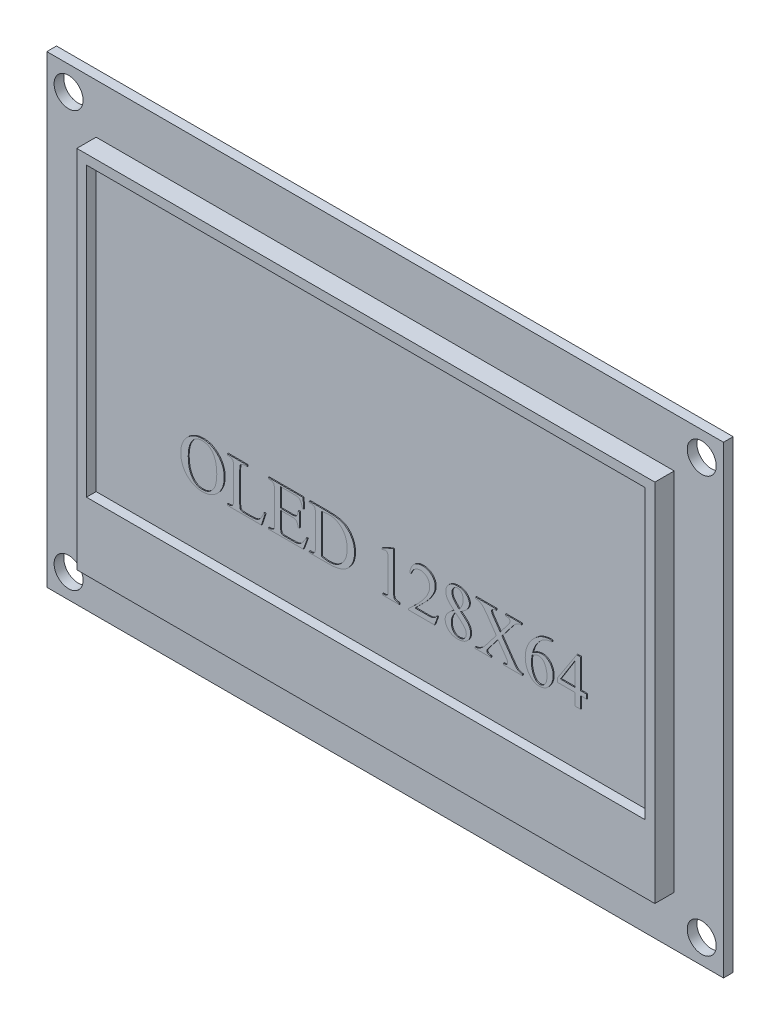
from build123d import *

# Parameters (mm, degrees)
SKETCH_1_W          = 70
SKETCH_1_H          = 48
SKETCH_1_R          = 1.5
EXTRUDE_1_DEPTH     = 1
SKETCH_2_W          = 59.8
SKETCH_2_H          = 37.76
EXTRUDE_2_DEPTH     = 2
SKETCH_3_W          = 57.8
SKETCH_3_H          = 29.76
CUT_EXTRUDE_1_DEPTH = 1
EXTRUDE_3_DEPTH     = 0.1


with BuildPart() as part:
    # 草图1 → 凸台-拉伸1 (new body)
    with BuildSketch(Plane.XY):
        Rectangle(SKETCH_1_W, SKETCH_1_H)
        with Locations((32.75, -21.5)):
            Circle(SKETCH_1_R, mode=Mode.SUBTRACT)
        with Locations((-32.75, -21.5)):
            Circle(SKETCH_1_R, mode=Mode.SUBTRACT)
        with Locations((-32.75, 21.5)):
            Circle(SKETCH_1_R, mode=Mode.SUBTRACT)
        with Locations((32.75, 21.5)):
            Circle(SKETCH_1_R, mode=Mode.SUBTRACT)
    extrude(amount=EXTRUDE_1_DEPTH)

    # 草图2 → 凸台-拉伸2 (add)
    with BuildSketch(Plane.XY.offset(1)):
        Rectangle(SKETCH_2_W, SKETCH_2_H)
    extrude(amount=EXTRUDE_2_DEPTH)

    # 草图3 → 切除-拉伸1 (cut)
    with BuildSketch(Plane.XY.offset(3)):
        with Locations((0, 3.005725137)):
            Rectangle(SKETCH_3_W, SKETCH_3_H)
    extrude(amount=-CUT_EXTRUDE_1_DEPTH, mode=Mode.SUBTRACT)

    # 草图4 → 凸台-拉伸3 (add)
    # profile 1 of 10: a face of its own
    with BuildSketch(Plane.XY.offset(2)):
        with BuildLine():
            add(Edge.make_bspline(
                [(-17.753586123, -1.530934014), (-17.680218489, -1.532610624), (-17.535429437, -1.535919368), (-17.322451314, -1.569802119), (-17.116597062, -1.621593606), (-16.917768793, -1.694892085), (-16.727562194, -1.791569104), (-16.543953872, -1.907092204), (-16.368802784, -2.044912859), (-16.202965684, -2.20102301), (-16.049996212, -2.372250454), (-15.915569805, -2.556399611), (-15.803381402, -2.751979509), (-15.70980029, -2.956836452), (-15.638689347, -3.172985397), (-15.587938124, -3.399438043), (-15.555678704, -3.636162092), (-15.552212638, -3.797503808), (-15.550450251, -3.879541062)],
                knots=[0, 0, 0, 0, 0.98202372, 1.937997388, 2.881027266, 3.822118876, 4.769670076, 5.734044671, 6.723305605, 7.75005001, 8.781230837, 9.794598944, 10.798037779, 11.796394559, 12.806380977, 13.83982627, 14.901618723, 16, 16, 16, 16], degree=3))
            add(Edge.make_bspline(
                [(-15.550450251, -3.879541062), (-15.55221896, -3.964245851), (-15.555685042, -4.130239117), (-15.587617387, -4.37378712), (-15.639870529, -4.605647044), (-15.710776437, -4.827690851), (-15.804922402, -5.037706921), (-15.918561774, -5.237732402), (-16.053989226, -5.425855072), (-16.207714857, -5.601342109), (-16.375661417, -5.760569713), (-16.554244215, -5.900268236), (-16.741768998, -6.018364462), (-16.937983201, -6.115267612), (-17.143296444, -6.189939013), (-17.357147798, -6.242963543), (-17.579668365, -6.275974983), (-17.731065996, -6.280188886), (-17.807761595, -6.282323581)],
                knots=[0, 0, 0, 0, 1.105289212, 2.165999938, 3.199623363, 4.204615257, 5.203215799, 6.19840424, 7.202665855, 8.223554404, 9.239475005, 10.219225154, 11.178454701, 12.127257531, 13.070460396, 14.024390953, 14.999188307, 16, 16, 16, 16], degree=3))
            add(Edge.make_bspline(
                [(-17.807761595, -6.282323581), (-17.885479121, -6.280694591), (-18.038263195, -6.277492174), (-18.261746487, -6.243375751), (-18.476416557, -6.193471043), (-18.680710998, -6.11895934), (-18.877066361, -6.025807916), (-19.062394966, -5.909294048), (-19.239764668, -5.774393726), (-19.403699126, -5.618272176), (-19.554109037, -5.446419077), (-19.68614253, -5.260512719), (-19.797028295, -5.061509884), (-19.887314439, -4.850498674), (-19.959271868, -4.628029152), (-20.008741327, -4.392638579), (-20.039567584, -4.145221771), (-20.043169884, -3.975946108), (-20.04500795, -3.889573557)],
                knots=[0, 0, 0, 0, 1.016462961, 1.998253932, 2.952703386, 3.896991157, 4.838708659, 5.79220409, 6.756996177, 7.750938477, 8.749908999, 9.742163126, 10.729801125, 11.72586164, 12.741928676, 13.785044703, 14.869823709, 16, 16, 16, 16], degree=3))
            add(Edge.make_bspline(
                [(-20.04500795, -3.889573557), (-20.042612612, -3.801512474), (-20.037912748, -3.628728905), (-20.00339739, -3.375550609), (-19.94570941, -3.134537044), (-19.862378015, -2.906615248), (-19.758126194, -2.690503476), (-19.629323097, -2.487479723), (-19.477581064, -2.296306115), (-19.360094198, -2.181828096), (-19.300596831, -2.123854461)],
                knots=[0, 0, 0, 0, 1.069821612, 2.099083859, 3.098457433, 4.075397538, 5.042245682, 6.008393354, 6.991416173, 8, 8, 8, 8], degree=3))
            add(Edge.make_bspline(
                [(-19.300596831, -2.123854461), (-19.246307998, -2.076258383), (-19.139039001, -1.982213564), (-18.964122508, -1.861802014), (-18.781655851, -1.759828797), (-18.591142231, -1.676274329), (-18.393040617, -1.610641242), (-18.186657547, -1.564816855), (-17.97279535, -1.535695966), (-17.827252682, -1.532534297), (-17.753586123, -1.530934014)],
                knots=[0, 0, 0, 0, 1.020331703, 2.016067603, 2.996330227, 3.972568804, 4.953652495, 5.942660639, 6.958675748, 8, 8, 8, 8], degree=3))
        make_face()
        with BuildLine():
            add(Edge.make_bspline(
                [(-17.81779409, -1.723557916), (-17.868044049, -1.724762323), (-17.966709884, -1.727127176), (-18.110638861, -1.749986438), (-18.246967611, -1.785876205), (-18.375798048, -1.836349985), (-18.496558509, -1.901997676), (-18.60990929, -1.981840252), (-18.715036683, -2.076843695), (-18.777319637, -2.149230761), (-18.809004583, -2.186055929)],
                knots=[0, 0, 0, 0, 1.063164563, 2.087524502, 3.076733094, 4.043076796, 5.009316746, 5.979698113, 6.972220307, 8, 8, 8, 8], degree=3))
            add(Edge.make_bspline(
                [(-18.809004583, -2.186055929), (-18.846704258, -2.236058423), (-18.923205511, -2.337524904), (-19.016722635, -2.508549497), (-19.097510987, -2.694770606), (-19.162002118, -2.898705521), (-19.213194815, -3.118718217), (-19.248386131, -3.35559836), (-19.271081388, -3.608553393), (-19.273346761, -3.782842707), (-19.274512344, -3.872518315)],
                knots=[0, 0, 0, 0, 0.842079542, 1.708771735, 2.616192816, 3.571533622, 4.583868732, 5.654197247, 6.793033924, 8, 8, 8, 8], degree=3))
            add(Edge.make_bspline(
                [(-19.274512344, -3.872518315), (-19.272857458, -3.964521515), (-19.269639019, -4.143450263), (-19.248039654, -4.403989243), (-19.209747198, -4.647908027), (-19.158441933, -4.876057513), (-19.09015781, -5.08761196), (-19.006689535, -5.282550644), (-18.91028387, -5.462844523), (-18.831053644, -5.570202055), (-18.791949341, -5.623188669)],
                knots=[0, 0, 0, 0, 1.194090181, 2.32227859, 3.389791915, 4.396332156, 5.354391058, 6.270237594, 7.146270854, 8, 8, 8, 8], degree=3))
            add(Edge.make_bspline(
                [(-18.791949341, -5.623188669), (-18.760676884, -5.660422356), (-18.699381319, -5.733402225), (-18.594638949, -5.827925118), (-18.483539104, -5.909616356), (-18.363994261, -5.975483216), (-18.237222533, -6.027665233), (-18.102914478, -6.063061636), (-17.961393143, -6.086231118), (-17.864373229, -6.088526475), (-17.814784342, -6.08969968)],
                knots=[0, 0, 0, 0, 1.03798799, 2.034507832, 3.00651136, 3.978961382, 4.943739978, 5.928402204, 6.941163471, 8, 8, 8, 8], degree=3))
            add(Edge.make_bspline(
                [(-17.814784342, -6.08969968), (-17.761854509, -6.088210363), (-17.657770414, -6.08528169), (-17.505264446, -6.060577566), (-17.360077494, -6.020161662), (-17.221155796, -5.965121118), (-17.090638517, -5.892115093), (-16.966598867, -5.80387169), (-16.850669568, -5.698796433), (-16.740431975, -5.579314156), (-16.640274336, -5.442022338), (-16.554066218, -5.285533039), (-16.482304548, -5.110135392), (-16.421991891, -4.917256272), (-16.376756307, -4.705586194), (-16.343649951, -4.476026515), (-16.325231982, -4.227969645), (-16.322406453, -4.056476653), (-16.320945857, -3.967827017)],
                knots=[0, 0, 0, 0, 0.868053581, 1.706987682, 2.527029803, 3.33706135, 4.152464395, 4.974651475, 5.829494242, 6.714957667, 7.637961825, 8.610582419, 9.638758338, 10.742501093, 11.922087167, 13.186154705, 14.545442825, 16, 16, 16, 16], degree=3))
            add(Edge.make_bspline(
                [(-16.320945857, -3.967827017), (-16.32208267, -3.871464513), (-16.324280597, -3.685156287), (-16.347101574, -3.415186181), (-16.382019435, -3.163913784), (-16.433296188, -2.931560576), (-16.49758456, -2.717527053), (-16.578694168, -2.523113345), (-16.671120075, -2.345366296), (-16.748618701, -2.24101389), (-16.786453618, -2.190068927)],
                knots=[0, 0, 0, 0, 1.235800575, 2.389309172, 3.472797871, 4.487583422, 5.438786723, 6.335007093, 7.187148569, 8, 8, 8, 8], degree=3))
            add(Edge.make_bspline(
                [(-16.786453618, -2.190068927), (-16.817948502, -2.152709305), (-16.880185923, -2.078882505), (-16.989085265, -1.984996018), (-17.105069716, -1.903643246), (-17.230281452, -1.836998444), (-17.364749, -1.785510383), (-17.508000239, -1.75008478), (-17.659867941, -1.726960646), (-17.76419847, -1.724712705), (-17.81779409, -1.723557916)],
                knots=[0, 0, 0, 0, 0.998031887, 1.97222284, 2.930434429, 3.891254661, 4.86556567, 5.867574261, 6.904551903, 8, 8, 8, 8], degree=3))
        make_face(mode=Mode.SUBTRACT)
    # profile 2 of 10: a face of its own
    with BuildSketch(Plane.XY.offset(2)):
        with BuildLine():
            Line((-11.441140355, -4.998164239), (-11.312724421, -5.021238977))
            Line((-11.312724421, -5.021238977), (-11.697972224, -6.218115614))
            Line((-11.697972224, -6.218115614), (-15.229410416, -6.218115614))
            Line((-15.229410416, -6.218115614), (-15.229410416, -6.08969968))
            Line((-15.229410416, -6.08969968), (-15.061867751, -6.08969968))
            add(Edge.make_bspline(
                [(-15.061867751, -6.08969968), (-15.039097151, -6.089159443), (-14.995036787, -6.088114101), (-14.931429728, -6.079026974), (-14.872573715, -6.063835478), (-14.818576141, -6.043452507), (-14.769938753, -6.015495164), (-14.727216454, -5.981193813), (-14.688067007, -5.941925747), (-14.667144458, -5.911481322), (-14.656554959, -5.896072529)],
                knots=[0, 0, 0, 0, 1.161464265, 2.247395222, 3.269655372, 4.258323134, 5.183235525, 6.118634609, 7.047787219, 8, 8, 8, 8], degree=3))
            add(Edge.make_bspline(
                [(-14.656554959, -5.896072529), (-14.650878321, -5.885512089), (-14.638177203, -5.861883769), (-14.625357763, -5.819602636), (-14.613249861, -5.769055335), (-14.603088495, -5.709423776), (-14.597152211, -5.640624754), (-14.590322679, -5.562777669), (-14.587985466, -5.476058071), (-14.58755525, -5.415180573), (-14.587330744, -5.383412042)],
                knots=[0, 0, 0, 0, 0.550464559, 1.231629699, 2.022772906, 2.943490705, 4.010570548, 5.198880139, 6.538253567, 8, 8, 8, 8], degree=3))
            Line((-14.587330744, -5.383412042), (-14.587330744, -2.429845554))
            add(Edge.make_bspline(
                [(-14.587330744, -2.429845554), (-14.587283632, -2.3947208), (-14.587194284, -2.328108003), (-14.592946337, -2.233135776), (-14.599242719, -2.148377144), (-14.609077902, -2.073987372), (-14.62189801, -2.009819252), (-14.637871211, -1.956276666), (-14.654735947, -1.911241113), (-14.671789999, -1.887821168), (-14.679629697, -1.877055087)],
                knots=[0, 0, 0, 0, 1.484107705, 2.814555366, 4.019988359, 5.075390106, 5.984573864, 6.780592097, 7.4394417, 8, 8, 8, 8], degree=3))
            add(Edge.make_bspline(
                [(-14.679629697, -1.877055087), (-14.702636773, -1.853317399), (-14.748887556, -1.805597876), (-14.840099963, -1.756979383), (-14.946158626, -1.728945092), (-15.021882673, -1.725419538), (-15.061867751, -1.723557916)],
                knots=[0, 0, 0, 0, 0.928124107, 1.865794122, 2.873060895, 4, 4, 4, 4], degree=3))
            Line((-15.061867751, -1.723557916), (-15.229410416, -1.723557916))
            Line((-15.229410416, -1.723557916), (-15.229410416, -1.595141982))
            Line((-15.229410416, -1.595141982), (-13.174755468, -1.595141982))
            Line((-13.174755468, -1.595141982), (-13.174755468, -1.723557916))
            add(Edge.make_bspline(
                [(-13.174755468, -1.723557916), (-13.231290633, -1.723895673), (-13.335463528, -1.724518032), (-13.478086572, -1.73466924), (-13.594188123, -1.75327529), (-13.685399853, -1.782426687), (-13.755993366, -1.819253513), (-13.813248765, -1.858114076), (-13.85869119, -1.902041844), (-13.888060874, -1.94385914), (-13.905902747, -1.983523237), (-13.916217944, -2.021800212), (-13.925257632, -2.068396947), (-13.931770772, -2.123766048), (-13.937661458, -2.187993437), (-13.943135026, -2.260879646), (-13.944351489, -2.342561188), (-13.944940895, -2.399749767), (-13.945251073, -2.429845554)],
                knots=[0, 0, 0, 0, 2.135388661, 3.934712435, 5.396921196, 6.567476567, 7.533666755, 8.395801069, 9.173040373, 9.908931797, 10.310428977, 10.810209104, 11.402366068, 12.102810591, 12.914896488, 13.839298742, 14.862919719, 16, 16, 16, 16], degree=3))
            Line((-13.945251073, -2.429845554), (-13.945251073, -5.471697997))
            add(Edge.make_bspline(
                [(-13.945251073, -5.471697997), (-13.945114638, -5.517243418), (-13.944864333, -5.600801356), (-13.932563959, -5.71407113), (-13.920143628, -5.806175311), (-13.899925859, -5.856839303), (-13.891075601, -5.879017288)],
                knots=[0, 0, 0, 0, 1.320237883, 2.422117385, 3.309287413, 4, 4, 4, 4], degree=3))
            add(Edge.make_bspline(
                [(-13.891075601, -5.879017288), (-13.875394231, -5.901940503), (-13.843496168, -5.948569475), (-13.786341569, -5.985820752), (-13.7376202, -5.999666935), (-13.699650522, -6.006447385), (-13.650731188, -6.012120473), (-13.590826343, -6.016971996), (-13.519907946, -6.020857917), (-13.437969565, -6.024099562), (-13.34463626, -6.024382257), (-13.27875791, -6.025108381), (-13.243979682, -6.025491713)],
                knots=[0, 0, 0, 0, 1.192840014, 2.426400607, 2.832970907, 3.376643165, 4.08937609, 4.958642829, 5.97093294, 7.155619234, 8.498406181, 10, 10, 10, 10], degree=3))
            Line((-13.243979682, -6.025491713), (-12.910900853, -6.025491713))
            add(Edge.make_bspline(
                [(-12.910900853, -6.025491713), (-12.869094126, -6.025416143), (-12.788468939, -6.025270404), (-12.67241101, -6.020900448), (-12.565654324, -6.015293607), (-12.468883256, -6.006611197), (-12.381927782, -5.994338804), (-12.304883959, -5.980580538), (-12.236998469, -5.964904293), (-12.159259104, -5.939699694), (-12.070953322, -5.896358113), (-11.970692188, -5.83203506), (-11.876073323, -5.750584565), (-11.784593746, -5.651817239), (-11.695989977, -5.529372944), (-11.60989169, -5.378798053), (-11.522418251, -5.19948693), (-11.469374136, -5.068098392), (-11.441140355, -4.998164239)],
                knots=[0, 0, 0, 0, 1.015520045, 1.958452593, 2.820964462, 3.612367469, 4.317791521, 4.953587295, 5.513193728, 6.009017938, 6.935641285, 7.893331651, 8.89609874, 9.959585258, 11.157137459, 12.558834018, 14.168371213, 16, 16, 16, 16], degree=3))
        make_face()
    # profile 3 of 10: a face of its own
    with BuildSketch(Plane.XY.offset(2)):
        with BuildLine():
            Line((-9.707525243, -1.787765883), (-9.707525243, -3.714004897))
            Line((-9.707525243, -3.714004897), (-8.615989802, -3.714004897))
            add(Edge.make_bspline(
                [(-8.615989802, -3.714004897), (-8.58521749, -3.713557714), (-8.526305639, -3.712701609), (-8.44189614, -3.707977769), (-8.365444919, -3.699228649), (-8.297119513, -3.68615626), (-8.236651364, -3.670338842), (-8.183975815, -3.651550351), (-8.13880321, -3.628973936), (-8.114080351, -3.609088722), (-8.102326065, -3.599634455)],
                knots=[0, 0, 0, 0, 1.378497325, 2.639055229, 3.785499939, 4.822596556, 5.752813006, 6.582149435, 7.325894273, 8, 8, 8, 8], degree=3))
            add(Edge.make_bspline(
                [(-8.102326065, -3.599634455), (-8.088183223, -3.586318067), (-8.059405503, -3.559222008), (-8.023461153, -3.510100471), (-7.992144379, -3.454528673), (-7.966456917, -3.391630308), (-7.944017905, -3.321996566), (-7.927607263, -3.244991095), (-7.915245558, -3.160878166), (-7.91160133, -3.102400493), (-7.909702164, -3.071925225)],
                knots=[0, 0, 0, 0, 0.807057727, 1.642193325, 2.520961646, 3.456744241, 4.464785926, 5.562353087, 6.729635801, 8, 8, 8, 8], degree=3))
            Line((-7.909702164, -3.071925225), (-7.781286229, -3.071925225))
            Line((-7.781286229, -3.071925225), (-7.781286229, -4.548708469))
            Line((-7.781286229, -4.548708469), (-7.909702164, -4.548708469))
            add(Edge.make_bspline(
                [(-7.909702164, -4.548708469), (-7.917046466, -4.500822886), (-7.930337565, -4.414163603), (-7.952730439, -4.298828327), (-7.975272057, -4.211477313), (-7.994921515, -4.164660416), (-8.003004366, -4.145402176)],
                knots=[0, 0, 0, 0, 1.400091839, 2.533767946, 3.396862008, 4, 4, 4, 4], degree=3))
            add(Edge.make_bspline(
                [(-8.003004366, -4.145402176), (-8.013653455, -4.127143607), (-8.035067831, -4.090427242), (-8.081380073, -4.044006985), (-8.135445801, -4.002666676), (-8.20106331, -3.9677342), (-8.279868321, -3.939326396), (-8.376092572, -3.920043733), (-8.489967291, -3.908570681), (-8.572150233, -3.907304322), (-8.615989802, -3.906628798)],
                knots=[0, 0, 0, 0, 0.730339962, 1.468649003, 2.255043961, 3.085373338, 4.035675664, 5.150343399, 6.479882613, 8, 8, 8, 8], degree=3))
            Line((-8.615989802, -3.906628798), (-9.707525243, -3.906628798))
            Line((-9.707525243, -3.906628798), (-9.707525243, -5.487749988))
            add(Edge.make_bspline(
                [(-9.707525243, -5.487749988), (-9.707735356, -5.512834531), (-9.708136053, -5.560672229), (-9.705450266, -5.628537496), (-9.703936108, -5.688768852), (-9.700886141, -5.740948156), (-9.697191573, -5.785509816), (-9.69174774, -5.822183596), (-9.687869135, -5.851757599), (-9.674235373, -5.891610418), (-9.64128514, -5.940268315), (-9.589532535, -5.983925006), (-9.530661403, -6.004941673), (-9.470375627, -6.017600005), (-9.393946867, -6.023542103), (-9.337998093, -6.024799951), (-9.307228698, -6.025491713)],
                knots=[0, 0, 0, 0, 1.288677705, 2.45758408, 3.489098831, 4.38406774, 5.143209633, 5.784735894, 6.290376563, 6.670724524, 7.93849931, 9.258749462, 10.069240206, 11.124103354, 12.418381796, 14, 14, 14, 14], degree=3))
            Line((-9.307228698, -6.025491713), (-8.484564119, -6.025491713))
            add(Edge.make_bspline(
                [(-8.484564119, -6.025491713), (-8.420684074, -6.024610177), (-8.302198075, -6.022975087), (-8.138595701, -6.014212094), (-8.0030749, -5.996558042), (-7.890374354, -5.972122864), (-7.793038898, -5.933668381), (-7.702171727, -5.88242056), (-7.612332018, -5.818498037), (-7.557614782, -5.766375291), (-7.529470608, -5.739565609)],
                knots=[0, 0, 0, 0, 1.488287981, 2.760506628, 3.813793052, 4.66981318, 5.439445504, 6.241513751, 7.095510901, 8, 8, 8, 8], degree=3))
            add(Edge.make_bspline(
                [(-7.529470608, -5.739565609), (-7.491511045, -5.698120407), (-7.410189587, -5.609331599), (-7.298611772, -5.452106082), (-7.183883879, -5.268259524), (-7.112581363, -5.133436133), (-7.074998591, -5.062372206)],
                knots=[0, 0, 0, 0, 0.823493647, 1.764185327, 2.821526682, 4, 4, 4, 4], degree=3))
            Line((-7.074998591, -5.062372206), (-6.946582657, -5.062372206))
            Line((-6.946582657, -5.062372206), (-7.362931194, -6.218115614))
            Line((-7.362931194, -6.218115614), (-10.991684585, -6.218115614))
            Line((-10.991684585, -6.218115614), (-10.991684585, -6.08969968))
            Line((-10.991684585, -6.08969968), (-10.833171167, -6.08969968))
            add(Edge.make_bspline(
                [(-10.833171167, -6.08969968), (-10.807013633, -6.088730495), (-10.754602401, -6.086788561), (-10.677369364, -6.071189906), (-10.601977501, -6.046239247), (-10.554980756, -6.021806502), (-10.531193071, -6.009439721)],
                knots=[0, 0, 0, 0, 0.993225946, 1.990103322, 2.982678719, 4, 4, 4, 4], degree=3))
            add(Edge.make_bspline(
                [(-10.531193071, -6.009439721), (-10.514638047, -5.999746991), (-10.481897188, -5.980577684), (-10.441944932, -5.940265589), (-10.408730927, -5.894652912), (-10.38401615, -5.837358444), (-10.36770875, -5.762044571), (-10.356700898, -5.661608627), (-10.350244136, -5.532309406), (-10.349831783, -5.436257662), (-10.349604914, -5.383412042)],
                knots=[0, 0, 0, 0, 0.66731377, 1.319745957, 1.964608581, 2.628644155, 3.481257446, 4.645895262, 6.154643106, 8, 8, 8, 8], degree=3))
            Line((-10.349604914, -5.383412042), (-10.349604914, -2.429845554))
            add(Edge.make_bspline(
                [(-10.349604914, -2.429845554), (-10.349709071, -2.393392461), (-10.349905993, -2.324473254), (-10.353701217, -2.226391543), (-10.361124086, -2.139480451), (-10.368697054, -2.063125857), (-10.382910783, -1.998516869), (-10.39554324, -1.943852819), (-10.413139963, -1.900015997), (-10.428854308, -1.876527358), (-10.43588437, -1.866019343)],
                knots=[0, 0, 0, 0, 1.515681782, 2.865589051, 4.07921189, 5.143357036, 6.051434242, 6.827115058, 7.475291317, 8, 8, 8, 8], degree=3))
            add(Edge.make_bspline(
                [(-10.43588437, -1.866019343), (-10.45792076, -1.843913551), (-10.503648468, -1.798041825), (-10.597218237, -1.753506976), (-10.709043586, -1.728045708), (-10.789869243, -1.725123483), (-10.833171167, -1.723557916)],
                knots=[0, 0, 0, 0, 0.855227083, 1.774681568, 2.807797254, 4, 4, 4, 4], degree=3))
            Line((-10.833171167, -1.723557916), (-10.991684585, -1.723557916))
            Line((-10.991684585, -1.723557916), (-10.991684585, -1.595141982))
            Line((-10.991684585, -1.595141982), (-7.396038427, -1.595141982))
            Line((-7.396038427, -1.595141982), (-7.331830459, -2.622469456))
            Line((-7.331830459, -2.622469456), (-7.460246394, -2.622469456))
            add(Edge.make_bspline(
                [(-7.460246394, -2.622469456), (-7.466519412, -2.590350751), (-7.47856326, -2.528684611), (-7.497180185, -2.440188356), (-7.517802234, -2.359793396), (-7.536907276, -2.286804636), (-7.558684049, -2.222202272), (-7.579023594, -2.164875501), (-7.601157523, -2.115730036), (-7.630537156, -2.060468914), (-7.672774413, -1.999826109), (-7.735654413, -1.938130943), (-7.80798294, -1.883717584), (-7.863345692, -1.857399841), (-7.891643673, -1.843947854)],
                knots=[0, 0, 0, 0, 1.262230624, 2.423413114, 3.48701335, 4.463268595, 5.332045682, 6.115542347, 6.808324797, 7.408465274, 8.528517928, 9.641194136, 10.794325741, 12, 12, 12, 12], degree=3))
            add(Edge.make_bspline(
                [(-7.891643673, -1.843947854), (-7.919540568, -1.834761032), (-7.983181578, -1.813803193), (-8.096016892, -1.800170506), (-8.234478517, -1.788277409), (-8.336034672, -1.787946069), (-8.391261917, -1.787765883)],
                knots=[0, 0, 0, 0, 0.696394265, 1.588679787, 2.688700125, 4, 4, 4, 4], degree=3))
            Line((-8.391261917, -1.787765883), (-9.707525243, -1.787765883))
        make_face()
    # profile 4 of 10: a face of its own
    with BuildSketch(Plane.XY.offset(2)):
        with BuildLine():
            Line((-6.753958755, -6.218115614), (-6.753958755, -6.08969968))
            Line((-6.753958755, -6.08969968), (-6.586416091, -6.08969968))
            add(Edge.make_bspline(
                [(-6.586416091, -6.08969968), (-6.563644828, -6.089162262), (-6.51958318, -6.088122376), (-6.455985092, -6.078997114), (-6.397399754, -6.064016161), (-6.343788182, -6.043331414), (-6.296216136, -6.015239484), (-6.252160308, -5.983665936), (-6.214715787, -5.943723603), (-6.194404606, -5.913429086), (-6.184113047, -5.898079028)],
                knots=[0, 0, 0, 0, 1.170016541, 2.263943595, 3.293731011, 4.273677885, 5.205400736, 6.126759273, 7.050839703, 8, 8, 8, 8], degree=3))
            add(Edge.make_bspline(
                [(-6.184113047, -5.898079028), (-6.178130823, -5.887181214), (-6.16496147, -5.86319061), (-6.150438666, -5.820527973), (-6.139010395, -5.769321008), (-6.128867387, -5.709375622), (-6.121313516, -5.640699059), (-6.114994818, -5.562765517), (-6.112497862, -5.476061599), (-6.112091265, -5.415181783), (-6.111879084, -5.383412042)],
                knots=[0, 0, 0, 0, 0.568141805, 1.250715472, 2.052584266, 2.968455247, 4.031571596, 5.213625719, 6.545948453, 8, 8, 8, 8], degree=3))
            Line((-6.111879084, -5.383412042), (-6.111879084, -2.429845554))
            add(Edge.make_bspline(
                [(-6.111879084, -2.429845554), (-6.111831972, -2.3947208), (-6.111742624, -2.328108003), (-6.117494677, -2.233135776), (-6.123791059, -2.148377144), (-6.133626242, -2.073987372), (-6.14644635, -2.009819252), (-6.162419551, -1.956276666), (-6.179284287, -1.911241113), (-6.196338339, -1.887821168), (-6.204178037, -1.877055087)],
                knots=[0, 0, 0, 0, 1.484107705, 2.814555366, 4.019988359, 5.075390106, 5.984573864, 6.780592097, 7.4394417, 8, 8, 8, 8], degree=3))
            add(Edge.make_bspline(
                [(-6.204178037, -1.877055087), (-6.227185113, -1.853317399), (-6.273435896, -1.805597876), (-6.364648303, -1.756979383), (-6.470706966, -1.728945092), (-6.546431013, -1.725419538), (-6.586416091, -1.723557916)],
                knots=[0, 0, 0, 0, 0.928124107, 1.865794122, 2.873060895, 4, 4, 4, 4], degree=3))
            Line((-6.586416091, -1.723557916), (-6.753958755, -1.723557916))
            Line((-6.753958755, -1.723557916), (-6.753958755, -1.595141982))
            Line((-6.753958755, -1.595141982), (-4.859823725, -1.595141982))
            add(Edge.make_bspline(
                [(-4.859823725, -1.595141982), (-4.775537427, -1.595934095), (-4.611906532, -1.59747188), (-4.374341665, -1.608670348), (-4.152044031, -1.626104777), (-3.945826594, -1.651985804), (-3.755003394, -1.685179051), (-3.579491667, -1.724417461), (-3.419580415, -1.772460404), (-3.274072909, -1.828221232), (-3.139250074, -1.892119934), (-3.013142813, -1.966633932), (-2.893369879, -2.050084649), (-2.779940108, -2.142954014), (-2.674079906, -2.246442447), (-2.574099277, -2.359152582), (-2.481854588, -2.482367036), (-2.395971134, -2.613834305), (-2.318712988, -2.753252776), (-2.251572292, -2.898876794), (-2.194327501, -3.04974493), (-2.146776403, -3.205790838), (-2.110675105, -3.367471251), (-2.08645042, -3.534541254), (-2.06917295, -3.706622802), (-2.067583838, -3.823314486), (-2.066777155, -3.88255081)],
                knots=[0, 0, 0, 0, 1.467398357, 2.848763231, 4.139747069, 5.348651221, 6.465709142, 7.510884705, 8.477890948, 9.369935066, 10.221521294, 11.072291092, 11.917022873, 12.760911509, 13.621447043, 14.491775058, 15.381421868, 16.298684439, 17.223858558, 18.153856654, 19.088127867, 20.031156851, 20.991691223, 21.969088183, 22.969046064, 24, 24, 24, 24], degree=3))
            add(Edge.make_bspline(
                [(-2.066777155, -3.88255081), (-2.068332319, -3.961564825), (-2.071380512, -4.116435921), (-2.100645569, -4.343631505), (-2.146357298, -4.5609086), (-2.210503326, -4.768761918), (-2.294194445, -4.966254793), (-2.396533778, -5.153634372), (-2.515044456, -5.332821026), (-2.609284062, -5.441239854), (-2.656687853, -5.495775984)],
                knots=[0, 0, 0, 0, 1.077719575, 2.112379846, 3.120154608, 4.104514829, 5.075810074, 6.041644454, 7.014920789, 8, 8, 8, 8], degree=3))
            add(Edge.make_bspline(
                [(-2.656687853, -5.495775984), (-2.684730532, -5.525258213), (-2.741015161, -5.584432171), (-2.832474752, -5.666244116), (-2.928881474, -5.742747463), (-3.030887271, -5.813246446), (-3.138026733, -5.878333908), (-3.250809334, -5.937927082), (-3.369462052, -5.990582922), (-3.492777033, -6.039114469), (-3.621905854, -6.081035239), (-3.756052635, -6.1182299), (-3.896011993, -6.149429142), (-4.041431498, -6.173990248), (-4.191953761, -6.194357413), (-4.34794625, -6.208263961), (-4.50927201, -6.216172878), (-4.618700814, -6.217461696), (-4.67422257, -6.218115614)],
                knots=[0, 0, 0, 0, 0.884547214, 1.775380039, 2.665826882, 3.559504879, 4.469980105, 5.390593375, 6.331323642, 7.291529335, 8.271228182, 9.282197471, 10.317896576, 11.387954191, 12.488469157, 13.620281033, 14.792583212, 16, 16, 16, 16], degree=3))
            Line((-4.67422257, -6.218115614), (-6.753958755, -6.218115614))
        make_face()
        with BuildLine():
            add(Edge.make_bspline(
                [(-5.469799413, -5.927173263), (-5.398708634, -5.94233323), (-5.263071194, -5.971257643), (-5.06700948, -6.000424948), (-4.889383302, -6.021764901), (-4.776607766, -6.024296765), (-4.723381795, -6.025491713)],
                knots=[0, 0, 0, 0, 1.156263879, 2.206090244, 3.153339526, 4, 4, 4, 4], degree=3))
            add(Edge.make_bspline(
                [(-4.723381795, -6.025491713), (-4.65706767, -6.023837998), (-4.52654577, -6.020583094), (-4.335413511, -5.992489488), (-4.152395433, -5.948711264), (-3.978052482, -5.886310994), (-3.81254346, -5.80555953), (-3.656054882, -5.706672609), (-3.509336959, -5.589009734), (-3.370724041, -5.456431487), (-3.24606605, -5.30709483), (-3.135669535, -5.144863979), (-3.043298978, -4.969361595), (-2.967935726, -4.781296458), (-2.908531587, -4.580833824), (-2.866937699, -4.367196069), (-2.841387215, -4.141011154), (-2.838665289, -3.985954983), (-2.837272761, -3.906628798)],
                knots=[0, 0, 0, 0, 0.997996022, 1.964292496, 2.902202989, 3.827540679, 4.746320531, 5.669683403, 6.608607029, 7.573643287, 8.552931756, 9.531909504, 10.522958759, 11.532773866, 12.577887131, 13.666093008, 14.805981493, 16, 16, 16, 16], degree=3))
            add(Edge.make_bspline(
                [(-2.837272761, -3.906628798), (-2.838662048, -3.826634947), (-2.841372328, -3.670579573), (-2.866823697, -3.443369925), (-2.908676774, -3.229118592), (-2.967947458, -3.027973693), (-3.043096412, -2.839135345), (-3.135441346, -2.663561827), (-3.24604152, -2.502066693), (-3.371141879, -2.353876728), (-3.509161335, -2.220542803), (-3.658225032, -2.10455561), (-3.81710175, -2.006634849), (-3.985151497, -1.925313065), (-4.164188561, -1.865114123), (-4.351231178, -1.819021541), (-4.548422146, -1.793045805), (-4.682844779, -1.789550416), (-4.751472781, -1.787765883)],
                knots=[0, 0, 0, 0, 1.193396302, 2.328127765, 3.406675227, 4.447298146, 5.452780722, 6.435033879, 7.401194227, 8.367973033, 9.324444072, 10.259799173, 11.180785527, 12.104889921, 13.03919269, 13.994204462, 14.975963072, 16, 16, 16, 16], degree=3))
            add(Edge.make_bspline(
                [(-4.751472781, -1.787765883), (-4.805697474, -1.788957905), (-4.918469558, -1.791436976), (-5.092719334, -1.811712086), (-5.278174027, -1.844045153), (-5.404392176, -1.873717591), (-5.469799413, -1.889094081)],
                knots=[0, 0, 0, 0, 0.894670856, 1.860663297, 2.891378894, 4, 4, 4, 4], degree=3))
            Line((-5.469799413, -1.889094081), (-5.469799413, -5.927173263))
        make_face(mode=Mode.SUBTRACT)
    # profile 5 of 10: a face of its own
    with BuildSketch(Plane.XY.offset(2)):
        with BuildLine():
            Line((0.758373398, -2.044597751), (1.862951082, -1.530934014))
            Line((1.862951082, -1.530934014), (1.978324773, -1.530934014))
            Line((1.978324773, -1.530934014), (1.978324773, -5.383412042))
            add(Edge.make_bspline(
                [(1.978324773, -5.383412042), (1.978723045, -5.415179467), (1.97947767, -5.475370771), (1.979572823, -5.56102721), (1.983480212, -5.636887831), (1.985386099, -5.703561629), (1.991290334, -5.760632302), (1.995201395, -5.809048876), (2.002590035, -5.847745285), (2.011164044, -5.886868687), (2.0288333, -5.926869063), (2.058804892, -5.9680404), (2.097530272, -6.003111402), (2.146821187, -6.034876754), (2.215133641, -6.057185183), (2.305654473, -6.074495011), (2.422192878, -6.085635416), (2.508686377, -6.088258722), (2.556196477, -6.08969968)],
                knots=[0, 0, 0, 0, 1.356933168, 2.571048021, 3.657379777, 4.601012336, 5.418253307, 6.107533085, 6.673460353, 7.099554724, 7.815972102, 8.521630774, 9.259509655, 10.036179522, 11.007509208, 12.304408113, 13.970044684, 16, 16, 16, 16], degree=3))
            Line((2.556196477, -6.08969968), (2.556196477, -6.218115614))
            Line((2.556196477, -6.218115614), (0.822581365, -6.218115614))
            Line((0.822581365, -6.218115614), (0.822581365, -6.08969968))
            add(Edge.make_bspline(
                [(0.822581365, -6.08969968), (0.871102547, -6.088321773), (0.958947038, -6.085827161), (1.07635163, -6.074192106), (1.165704734, -6.058630453), (1.231400251, -6.036818439), (1.276767806, -6.005763142), (1.31383053, -5.974120769), (1.342042101, -5.936707784), (1.362211988, -5.901866909), (1.373985926, -5.866193578), (1.379931254, -5.828262427), (1.387616563, -5.780254487), (1.391758573, -5.721204711), (1.39585577, -5.651656964), (1.399035983, -5.571714842), (1.399352262, -5.481059628), (1.400072312, -5.417187273), (1.400453069, -5.383412042)],
                knots=[0, 0, 0, 0, 2.071302469, 3.74996044, 5.029173581, 5.941282905, 6.673651071, 7.361112001, 8.012044112, 8.663601818, 9.069808009, 9.607263055, 10.29959599, 11.144699654, 12.131164582, 13.273777592, 14.558393644, 16, 16, 16, 16], degree=3))
            Line((1.400453069, -5.383412042), (1.400453069, -2.879301324))
            add(Edge.make_bspline(
                [(1.400453069, -2.879301324), (1.400677106, -2.841843803), (1.401105217, -2.770266626), (1.398207951, -2.667958511), (1.397312748, -2.575927513), (1.392358515, -2.494733029), (1.389471801, -2.424018449), (1.382612473, -2.364291115), (1.377807613, -2.314462036), (1.371268406, -2.285337536), (1.368349086, -2.272335385)],
                knots=[0, 0, 0, 0, 1.476765178, 2.821934835, 4.035278551, 5.104597693, 6.029081604, 6.824151588, 7.47506195, 8, 8, 8, 8], degree=3))
            add(Edge.make_bspline(
                [(1.368349086, -2.272335385), (1.364092319, -2.256146855), (1.356023428, -2.225460775), (1.33778245, -2.183337072), (1.314519792, -2.147502973), (1.277628407, -2.109286093), (1.219453271, -2.074717003), (1.167219367, -2.070049906), (1.140611452, -2.06767249)],
                knots=[0, 0, 0, 0, 0.903062441, 1.711795068, 2.468214314, 3.196286531, 4.571790261, 6, 6, 6, 6], degree=3))
            add(Edge.make_bspline(
                [(1.140611452, -2.06767249), (1.118790669, -2.069454521), (1.070174221, -2.073424867), (0.991934556, -2.093729139), (0.902371469, -2.127711658), (0.840095955, -2.157147649), (0.806529373, -2.173013686)],
                knots=[0, 0, 0, 0, 0.743837888, 1.657262055, 2.737261251, 4, 4, 4, 4], degree=3))
            Line((0.806529373, -2.173013686), (0.758373398, -2.044597751))
        make_face()
    # profile 6 of 10: a face of its own
    with BuildSketch(Plane.XY.offset(2)):
        with BuildLine():
            Line((6.537090439, -5.332246318), (6.217053853, -6.218115614))
            Line((6.217053853, -6.218115614), (3.519315984, -6.218115614))
            Line((3.519315984, -6.218115614), (3.519315984, -6.092709429))
            add(Edge.make_bspline(
                [(3.519315984, -6.092709429), (3.615846364, -6.003990359), (3.802944326, -5.832032504), (4.070741626, -5.578770839), (4.316084727, -5.337775221), (4.539032332, -5.109140377), (4.739789465, -4.893021781), (4.917882344, -4.688738092), (5.074775693, -4.498081033), (5.20974157, -4.317451053), (5.326995858, -4.145686483), (5.426322639, -3.977863019), (5.51102463, -3.814180042), (5.581234924, -3.654369441), (5.634498027, -3.497488153), (5.672921542, -3.344541855), (5.697303217, -3.195434222), (5.700713795, -3.097092416), (5.702386866, -3.048850487)],
                knots=[0, 0, 0, 0, 1.640196139, 3.179075376, 4.61094688, 5.942305235, 7.173872596, 8.30065911, 9.332401675, 10.262017718, 11.120692698, 11.932909408, 12.700076558, 13.425218913, 14.114511764, 14.770003029, 15.396620544, 16, 16, 16, 16], degree=3))
            add(Edge.make_bspline(
                [(5.702386866, -3.048850487), (5.701739079, -3.013024831), (5.700469214, -2.942795388), (5.686885138, -2.84009095), (5.665733232, -2.742135119), (5.63733362, -2.648620966), (5.598161978, -2.56074258), (5.552717329, -2.476962613), (5.496333773, -2.399473238), (5.433895642, -2.326655207), (5.365171313, -2.260980991), (5.292423674, -2.203510811), (5.216969203, -2.153689553), (5.137662402, -2.113287675), (5.054515669, -2.083360984), (4.968560577, -2.061249075), (4.879237328, -2.046314945), (4.818250338, -2.045174308), (4.787423335, -2.044597751)],
                knots=[0, 0, 0, 0, 1.134419306, 2.223815103, 3.275304008, 4.307399035, 5.313221346, 6.318597171, 7.32112197, 8.342723066, 9.354331769, 10.327252885, 11.276405737, 12.214555788, 13.139633085, 14.069852934, 15.024371439, 16, 16, 16, 16], degree=3))
            add(Edge.make_bspline(
                [(4.787423335, -2.044597751), (4.731687068, -2.04672444), (4.621933244, -2.050912239), (4.462434789, -2.089806461), (4.311664077, -2.151646177), (4.171160088, -2.238072468), (4.043795786, -2.348238242), (3.932990189, -2.481801422), (3.840920313, -2.638914339), (3.796864826, -2.755143352), (3.774141354, -2.815093357)],
                knots=[0, 0, 0, 0, 0.978774112, 1.927366301, 2.868767021, 3.835023234, 4.81480387, 5.817007219, 6.874029602, 8, 8, 8, 8], degree=3))
            Line((3.774141354, -2.815093357), (3.647731918, -2.815093357))
            add(Edge.make_bspline(
                [(3.647731918, -2.815093357), (3.655310543, -2.76478158), (3.670117556, -2.666483125), (3.704954978, -2.524862263), (3.746408733, -2.391667143), (3.79813779, -2.268288494), (3.856183978, -2.152665824), (3.92329562, -2.046432238), (3.998980449, -1.949029829), (4.083681905, -1.861978905), (4.17442855, -1.783669453), (4.271538826, -1.71631825), (4.373431274, -1.657952795), (4.481973512, -1.612675825), (4.595300651, -1.575846265), (4.713953564, -1.550263219), (4.838102667, -1.533360134), (4.922804273, -1.531753428), (4.966001743, -1.530934014)],
                knots=[0, 0, 0, 0, 1.200501633, 2.345523519, 3.439068721, 4.490246694, 5.499995932, 6.48995494, 7.451685612, 8.406391985, 9.352574024, 10.27676432, 11.192316343, 12.119031984, 13.047762957, 14.001652993, 14.980851257, 16, 16, 16, 16], degree=3))
            add(Edge.make_bspline(
                [(4.966001743, -1.530934014), (5.011857049, -1.532230911), (5.10184293, -1.534775926), (5.234301742, -1.550671666), (5.360831372, -1.579003311), (5.482160663, -1.617773934), (5.59655514, -1.669740225), (5.70610665, -1.730748526), (5.808666872, -1.804971132), (5.904811358, -1.888406056), (5.993144864, -1.978853436), (6.068943237, -2.075756128), (6.135742176, -2.175053237), (6.187270399, -2.28019757), (6.229155573, -2.388494284), (6.259440166, -2.500700238), (6.276639761, -2.617588352), (6.279039106, -2.696654565), (6.280258571, -2.736839897)],
                knots=[0, 0, 0, 0, 1.109419983, 2.177111989, 3.221343547, 4.242152537, 5.252521162, 6.255999647, 7.270763728, 8.308866099, 9.333003754, 10.32358272, 11.281716678, 12.222409134, 13.149434629, 14.0874794, 15.027963099, 16, 16, 16, 16], degree=3))
            add(Edge.make_bspline(
                [(6.280258571, -2.736839897), (6.278404241, -2.795174812), (6.274669486, -2.912665609), (6.241569646, -3.087826359), (6.190949688, -3.26348055), (6.141158123, -3.376414195), (6.115725655, -3.43409829)],
                knots=[0, 0, 0, 0, 0.968670703, 1.950973842, 2.953401185, 4, 4, 4, 4], degree=3))
            add(Edge.make_bspline(
                [(6.115725655, -3.43409829), (6.093596739, -3.480566734), (6.048470528, -3.575327129), (5.967625605, -3.714448653), (5.879714398, -3.856899984), (5.782214483, -4.001889521), (5.673935414, -4.148050974), (5.554649079, -4.295321122), (5.427772636, -4.446329105), (5.337235575, -4.545351839), (5.291054577, -4.595861195)],
                knots=[0, 0, 0, 0, 0.863272392, 1.760421205, 2.69783519, 3.672094839, 4.691137575, 5.748887515, 6.851756197, 8, 8, 8, 8], degree=3))
            add(Edge.make_bspline(
                [(5.291054577, -4.595861195), (5.222876696, -4.666130343), (5.093111113, -4.799876313), (4.907680216, -4.98966289), (4.740349022, -5.158095777), (4.593697322, -5.30806645), (4.464248034, -5.435789775), (4.354685852, -5.543947671), (4.263629046, -5.631152468), (4.208603607, -5.68210498), (4.184470394, -5.704451877)],
                knots=[0, 0, 0, 0, 1.500005584, 2.855018295, 4.065062351, 5.137441976, 6.068514136, 6.851077111, 7.496102131, 8, 8, 8, 8], degree=3))
            Line((4.184470394, -5.704451877), (5.405425018, -5.704451877))
            add(Edge.make_bspline(
                [(5.405425018, -5.704451877), (5.462950159, -5.704069632), (5.568661647, -5.703367195), (5.713182427, -5.698434963), (5.829778685, -5.691436495), (5.922781821, -5.679523905), (6.000410434, -5.661658763), (6.070253287, -5.637613573), (6.136849981, -5.607312557), (6.199284685, -5.56865624), (6.258734561, -5.522811666), (6.31325949, -5.467296746), (6.365038067, -5.404440241), (6.393875887, -5.356729762), (6.408674505, -5.332246318)],
                knots=[0, 0, 0, 0, 1.823242483, 3.350494689, 4.582960761, 5.524351838, 6.318821823, 7.103187077, 7.861997978, 8.632781373, 9.425765109, 10.235225094, 11.094375721, 12, 12, 12, 12], degree=3))
            Line((6.408674505, -5.332246318), (6.537090439, -5.332246318))
        make_face()
    # profile 7 of 10: a face of its own
    with BuildSketch(Plane.XY.offset(2)):
        with BuildLine():
            add(Edge.make_bspline(
                [(8.213520331, -3.901612551), (8.170863396, -3.865373278), (8.088857655, -3.795705159), (7.973578912, -3.691851466), (7.868677586, -3.595412762), (7.777260653, -3.50243557), (7.696843863, -3.415793341), (7.628649371, -3.334118271), (7.570326369, -3.259600163), (7.512267799, -3.166167649), (7.455856838, -3.051423317), (7.407026481, -2.91138865), (7.378047476, -2.768122615), (7.373881361, -2.67175552), (7.371794012, -2.623472705)],
                knots=[0, 0, 0, 0, 1.270334399, 2.442151877, 3.521609927, 4.503819313, 5.400926142, 6.203674633, 6.918699616, 7.546270131, 8.697027482, 9.81322117, 10.904357984, 12, 12, 12, 12], degree=3))
            add(Edge.make_bspline(
                [(7.371794012, -2.623472705), (7.372653016, -2.586957811), (7.374355958, -2.514568496), (7.391088489, -2.408387462), (7.417033445, -2.305686255), (7.454584546, -2.207354554), (7.501700741, -2.112186729), (7.560891629, -2.021774409), (7.62880491, -1.934032089), (7.70803584, -1.852173364), (7.795982375, -1.777676413), (7.890375897, -1.710065548), (7.993660769, -1.655848101), (8.10247663, -1.608411962), (8.21924467, -1.57412734), (8.342387841, -1.548939085), (8.472309221, -1.533653187), (8.561272003, -1.531854434), (8.606794129, -1.530934014)],
                knots=[0, 0, 0, 0, 0.950255676, 1.88384385, 2.792107842, 3.704371182, 4.619622564, 5.552072711, 6.513713376, 7.505329987, 8.512277874, 9.512537765, 10.52174271, 11.54405161, 12.599252995, 13.683802626, 14.814805168, 16, 16, 16, 16], degree=3))
            add(Edge.make_bspline(
                [(8.606794129, -1.530934014), (8.650979571, -1.531907373), (8.737238733, -1.533807571), (8.863326154, -1.548344346), (8.983063711, -1.570673397), (9.096021176, -1.604393158), (9.202944774, -1.646040404), (9.302595618, -1.698638066), (9.39553933, -1.760334028), (9.481160246, -1.829973526), (9.55790328, -1.906023561), (9.625689088, -1.985379854), (9.682888759, -2.067863969), (9.730866698, -2.152441538), (9.767249935, -2.240078958), (9.791933411, -2.330515229), (9.809235587, -2.423167641), (9.810871307, -2.486281525), (9.811696762, -2.518131509)],
                knots=[0, 0, 0, 0, 1.224543267, 2.390562807, 3.514131841, 4.596523858, 5.653488695, 6.690135256, 7.713432089, 8.741379247, 9.744318369, 10.704578117, 11.630345281, 12.522646682, 13.395473805, 14.252453057, 15.118112569, 16, 16, 16, 16], degree=3))
            add(Edge.make_bspline(
                [(9.811696762, -2.518131509), (9.809547678, -2.561484991), (9.805188327, -2.649426211), (9.769294615, -2.781176829), (9.713882129, -2.913770619), (9.649502722, -3.023939521), (9.583967748, -3.113472364), (9.521176468, -3.184585659), (9.446627327, -3.258401128), (9.360995343, -3.336217018), (9.262816908, -3.415718019), (9.152511066, -3.498401865), (9.030616966, -3.584220686), (8.944368392, -3.641321132), (8.899742979, -3.670865169)],
                knots=[0, 0, 0, 0, 1.016333837, 2.061602268, 3.184162116, 4.383785178, 5.046360753, 5.786310426, 6.607834291, 7.508165667, 8.501253676, 9.57200422, 10.743743691, 12, 12, 12, 12], degree=3))
            add(Edge.make_bspline(
                [(8.899742979, -3.670865169), (8.947382019, -3.707792784), (9.038984812, -3.778799099), (9.168470005, -3.884127504), (9.285096612, -3.983614467), (9.38951549, -4.076877948), (9.482077491, -4.163656427), (9.561096408, -4.244921329), (9.628714752, -4.319128439), (9.666539846, -4.368868061), (9.684284077, -4.392201549)],
                knots=[0, 0, 0, 0, 1.353721433, 2.603005083, 3.748424961, 4.79631346, 5.747345757, 6.597165431, 7.341912503, 8, 8, 8, 8], degree=3))
            add(Edge.make_bspline(
                [(9.684284077, -4.392201549), (9.704742039, -4.4206909), (9.744973959, -4.476717072), (9.797745004, -4.564239568), (9.840142927, -4.653858069), (9.877256544, -4.743561825), (9.905164394, -4.834977836), (9.925398484, -4.927894742), (9.937747646, -5.02190833), (9.939326235, -5.085076802), (9.940112696, -5.116547678)],
                knots=[0, 0, 0, 0, 1.076508892, 2.11702522, 3.131748298, 4.117335487, 5.0947621, 6.061291635, 7.034124926, 8, 8, 8, 8], degree=3))
            add(Edge.make_bspline(
                [(9.940112696, -5.116547678), (9.938936251, -5.15607507), (9.936622002, -5.233831535), (9.918885244, -5.34809599), (9.891088331, -5.458252803), (9.850562471, -5.564235962), (9.798211601, -5.665724565), (9.734239522, -5.762548786), (9.659904014, -5.855481616), (9.573588678, -5.941853887), (9.479329318, -6.022143563), (9.376046278, -6.091492788), (9.266410817, -6.151110025), (9.149082059, -6.199647111), (9.024462792, -6.236114514), (8.893045573, -6.263605903), (8.754344933, -6.279781138), (8.65934012, -6.281463931), (8.610807127, -6.282323581)],
                knots=[0, 0, 0, 0, 0.960021755, 1.888510616, 2.802920607, 3.715885462, 4.638918763, 5.571911865, 6.531245679, 7.525223574, 8.534362485, 9.534960352, 10.542036352, 11.562074637, 12.613506034, 13.692334021, 14.821134072, 16, 16, 16, 16], degree=3))
            add(Edge.make_bspline(
                [(8.610807127, -6.282323581), (8.557904807, -6.281330498), (8.455077719, -6.279400225), (8.30527376, -6.25971449), (8.16456336, -6.228317004), (8.032976982, -6.182459572), (7.910054237, -6.125344267), (7.795399735, -6.055791096), (7.690418769, -5.972227145), (7.628589122, -5.907515977), (7.597525146, -5.87500429)],
                knots=[0, 0, 0, 0, 1.126390487, 2.189383279, 3.212453444, 4.192477901, 5.151776479, 6.094989804, 7.042899434, 8, 8, 8, 8], degree=3))
            add(Edge.make_bspline(
                [(7.597525146, -5.87500429), (7.574178878, -5.848050206), (7.528280599, -5.795059034), (7.470944209, -5.708891859), (7.419980075, -5.622640061), (7.378331248, -5.53416095), (7.347648319, -5.443046396), (7.323909516, -5.350981135), (7.310928277, -5.256364897), (7.308708788, -5.192830135), (7.307586044, -5.160690656)],
                knots=[0, 0, 0, 0, 1.084180769, 2.131476927, 3.143922951, 4.13198158, 5.100772593, 6.065921521, 7.021633618, 8, 8, 8, 8], degree=3))
            add(Edge.make_bspline(
                [(7.307586044, -5.160690656), (7.310200405, -5.109957628), (7.31548398, -5.007427121), (7.35600882, -4.855166469), (7.42015181, -4.703901225), (7.494585857, -4.58096302), (7.567071807, -4.481712476), (7.632652034, -4.40478295), (7.707443715, -4.325595705), (7.789856765, -4.243272252), (7.883420282, -4.16124633), (7.984443702, -4.075886817), (8.095007042, -3.988302911), (8.173192078, -3.931111949), (8.213520331, -3.901612551)],
                knots=[0, 0, 0, 0, 1.13299766, 2.289767261, 3.499112715, 4.796562079, 5.491837007, 6.245135494, 7.054337089, 7.926555877, 8.847851079, 9.834692501, 10.883123022, 12, 12, 12, 12], degree=3))
        make_face()
        with BuildLine():
            add(Edge.make_bspline(
                [(8.74122956, -3.538436236), (8.763418236, -3.508758869), (8.806278904, -3.451432698), (8.866404255, -3.367087877), (8.920817493, -3.288179174), (8.968241268, -3.213496147), (9.009133171, -3.143927595), (9.043827439, -3.079092709), (9.071908196, -3.019119154), (9.101783786, -2.944821524), (9.129693444, -2.851223012), (9.152357268, -2.734250227), (9.166717318, -2.610450201), (9.168634636, -2.525529042), (9.169617091, -2.482014527)],
                knots=[0, 0, 0, 0, 1.143795191, 2.209407538, 3.197229654, 4.102178591, 4.939607759, 5.6877161, 6.371214356, 6.982710641, 8.15834461, 9.379113276, 10.657029488, 12, 12, 12, 12], degree=3))
            add(Edge.make_bspline(
                [(9.169617091, -2.482014527), (9.168261118, -2.42601542), (9.165674408, -2.319189256), (9.136150121, -2.168757957), (9.089675654, -2.036458618), (9.023165256, -1.92484308), (8.940437159, -1.834445703), (8.841461643, -1.768984824), (8.72717366, -1.730761412), (8.646545718, -1.726015747), (8.60478763, -1.723557916)],
                knots=[0, 0, 0, 0, 1.261659935, 2.406793553, 3.442535955, 4.410274898, 5.317678144, 6.183913978, 7.059429309, 8, 8, 8, 8], degree=3))
            add(Edge.make_bspline(
                [(8.60478763, -1.723557916), (8.562990887, -1.725554922), (8.481196034, -1.729462998), (8.365531562, -1.769597591), (8.262060741, -1.833379282), (8.175016612, -1.921662963), (8.103411211, -2.024666704), (8.051549611, -2.139266213), (8.01907124, -2.262192546), (8.015626427, -2.347376599), (8.013873683, -2.390718824)],
                knots=[0, 0, 0, 0, 1.007663284, 1.971963922, 2.923664585, 3.924585392, 4.947712443, 5.943127521, 6.953449296, 8, 8, 8, 8], degree=3))
            add(Edge.make_bspline(
                [(8.013873683, -2.390718824), (8.015012635, -2.420185817), (8.017288265, -2.479060954), (8.030421616, -2.567647545), (8.054242378, -2.65562756), (8.084693111, -2.743989205), (8.125649553, -2.830505642), (8.173521661, -2.915376273), (8.229177226, -2.998601155), (8.271306582, -3.051159381), (8.29277704, -3.077944722)],
                knots=[0, 0, 0, 0, 0.934968321, 1.868069415, 2.832888416, 3.822577371, 4.828672529, 5.864143669, 6.91149978, 8, 8, 8, 8], degree=3))
            Line((8.29277704, -3.077944722), (8.74122956, -3.538436236))
        make_face(mode=Mode.SUBTRACT)
        with BuildLine():
            add(Edge.make_bspline(
                [(8.3710305, -4.031031734), (8.3368176, -4.070552411), (8.269552867, -4.148252571), (8.182918217, -4.27417006), (8.108946525, -4.404328324), (8.050954498, -4.540971844), (8.005171631, -4.682268944), (7.973740837, -4.829545991), (7.952457059, -4.982159791), (7.950603735, -5.086041661), (7.949665716, -5.138619167)],
                knots=[0, 0, 0, 0, 1.032692265, 2.030338571, 3.016018638, 3.987405609, 4.959602145, 5.947740132, 6.961294152, 8, 8, 8, 8], degree=3))
            add(Edge.make_bspline(
                [(7.949665716, -5.138619167), (7.950017725, -5.173772401), (7.950706864, -5.242593108), (7.962682493, -5.34271661), (7.97878059, -5.4379832), (8.004631233, -5.527256795), (8.035077658, -5.611926737), (8.073736414, -5.690756803), (8.118696262, -5.764309479), (8.170929179, -5.83121965), (8.228303281, -5.891796469), (8.290014957, -5.944834974), (8.355822271, -5.989316593), (8.425114266, -6.025935146), (8.49792574, -6.055221243), (8.5751758, -6.075097791), (8.655881201, -6.087528391), (8.711085522, -6.088966618), (8.739223061, -6.08969968)],
                knots=[0, 0, 0, 0, 1.215800546, 2.380214917, 3.485851197, 4.555835209, 5.592174076, 6.596409761, 7.58897179, 8.570608688, 9.528484987, 10.472555876, 11.38104859, 12.271595288, 13.180751324, 14.090349306, 15.026654623, 16, 16, 16, 16], degree=3))
            add(Edge.make_bspline(
                [(8.739223061, -6.08969968), (8.767013962, -6.089237092), (8.821450117, -6.088330986), (8.900640645, -6.077883796), (8.975532176, -6.061952041), (9.046064532, -6.039774201), (9.11291477, -6.01180709), (9.175016927, -5.97654813), (9.23308428, -5.935046442), (9.302472647, -5.871249461), (9.378616612, -5.782876432), (9.44330916, -5.661534278), (9.483612178, -5.529395606), (9.488268585, -5.437545901), (9.490656927, -5.390434788)],
                knots=[0, 0, 0, 0, 0.870102481, 1.704336101, 2.497498108, 3.266205996, 4.017293214, 4.763174923, 5.498758919, 6.247870839, 7.7126464, 9.128190877, 10.527005373, 12, 12, 12, 12], degree=3))
            add(Edge.make_bspline(
                [(9.490656927, -5.390434788), (9.489171852, -5.351175318), (9.486248661, -5.273897779), (9.461307227, -5.161181068), (9.420600123, -5.054451167), (9.38039491, -4.990234785), (9.360234493, -4.95803426)],
                knots=[0, 0, 0, 0, 1.026618141, 2.020774198, 3.007541246, 4, 4, 4, 4], degree=3))
            add(Edge.make_bspline(
                [(9.360234493, -4.95803426), (9.337567517, -4.926949075), (9.289459596, -4.860974523), (9.203987719, -4.762674508), (9.102996296, -4.657840746), (8.988419903, -4.543754049), (8.854663698, -4.426790922), (8.708502452, -4.299551071), (8.54601308, -4.166268651), (8.430790518, -4.077217821), (8.3710305, -4.031031734)],
                knots=[0, 0, 0, 0, 0.678640752, 1.440333101, 2.29601057, 3.247444537, 4.292277857, 5.430342317, 6.667250677, 8, 8, 8, 8], degree=3))
        make_face(mode=Mode.SUBTRACT)
    # profile 8 of 10: a face of its own
    with BuildSketch(Plane.XY.offset(2)):
        with BuildLine():
            Line((13.183618286, -3.710995148), (14.177838527, -5.144638664))
            add(Edge.make_bspline(
                [(14.177838527, -5.144638664), (14.210739405, -5.193272594), (14.273484334, -5.286021866), (14.36655313, -5.416587501), (14.450913206, -5.534250582), (14.530645934, -5.636969804), (14.603559903, -5.725683408), (14.668556871, -5.801788333), (14.727556402, -5.863442199), (14.798195078, -5.926685893), (14.889904249, -5.9884229), (15.01178693, -6.039901579), (15.145227623, -6.077692343), (15.239678616, -6.085611623), (15.288435708, -6.08969968)],
                knots=[0, 0, 0, 0, 1.387213777, 2.64554125, 3.788165293, 4.807523223, 5.71700237, 6.501159185, 7.171678612, 7.731371946, 8.739398536, 9.765470873, 10.846500828, 12, 12, 12, 12], degree=3))
            Line((15.288435708, -6.08969968), (15.288435708, -6.218115614))
            Line((15.288435708, -6.218115614), (13.320060216, -6.218115614))
            Line((13.320060216, -6.218115614), (13.320060216, -6.08969968))
            add(Edge.make_bspline(
                [(13.320060216, -6.08969968), (13.350848293, -6.088711663), (13.408184087, -6.086871706), (13.487694921, -6.079245259), (13.55450766, -6.06714866), (13.593395014, -6.053667327), (13.611002567, -6.047563202)],
                knots=[0, 0, 0, 0, 1.251101252, 2.329891665, 3.243802496, 4, 4, 4, 4], degree=3))
            add(Edge.make_bspline(
                [(13.611002567, -6.047563202), (13.633774702, -6.035841233), (13.679301132, -6.01240648), (13.728548438, -5.954012893), (13.766889141, -5.890805341), (13.771389396, -5.843377681), (13.773528984, -5.820828818)],
                knots=[0, 0, 0, 0, 1.037394414, 2.073976071, 3.08429699, 4, 4, 4, 4], degree=3))
            add(Edge.make_bspline(
                [(13.773528984, -5.820828818), (13.772021434, -5.793851141), (13.768953052, -5.738942294), (13.751371618, -5.686821723), (13.74242825, -5.6603089)],
                knots=[0, 0, 0, 0, 0.98263495, 2, 2, 2, 2], degree=3))
            add(Edge.make_bspline(
                [(13.74242825, -5.6603089), (13.735962116, -5.646147014), (13.719030258, -5.609063489), (13.679209322, -5.544821682), (13.624125319, -5.456193661), (13.581040355, -5.38968719), (13.556827095, -5.352311308)],
                knots=[0, 0, 0, 0, 0.51870283, 1.358246357, 2.515364433, 4, 4, 4, 4], degree=3))
            Line((13.556827095, -5.352311308), (12.780311992, -4.232684881))
            Line((12.780311992, -4.232684881), (11.824215232, -5.467684999))
            add(Edge.make_bspline(
                [(11.824215232, -5.467684999), (11.801429749, -5.495736641), (11.760171471, -5.546530493), (11.705585989, -5.614980695), (11.66702503, -5.669218215), (11.635663968, -5.71994678), (11.615707027, -5.777147964), (11.612248926, -5.821679295), (11.610523091, -5.843903556)],
                knots=[0, 0, 0, 0, 1.473021793, 2.66723954, 3.56721568, 4.18432866, 5.093852523, 6, 6, 6, 6], degree=3))
            add(Edge.make_bspline(
                [(11.610523091, -5.843903556), (11.611663096, -5.860457413), (11.613892392, -5.892828718), (11.63221749, -5.938680293), (11.661374783, -5.979781298), (11.702792085, -6.017559101), (11.762746124, -6.04662365), (11.840644294, -6.06891224), (11.939186851, -6.082768911), (12.011449038, -6.087250122), (12.050949616, -6.08969968)],
                knots=[0, 0, 0, 0, 0.706366786, 1.381310432, 2.079953945, 2.849973552, 3.752334519, 4.902211886, 6.306660411, 8, 8, 8, 8], degree=3))
            Line((12.050949616, -6.08969968), (12.050949616, -6.218115614))
            Line((12.050949616, -6.218115614), (10.414649703, -6.218115614))
            Line((10.414649703, -6.218115614), (10.414649703, -6.08969968))
            add(Edge.make_bspline(
                [(10.414649703, -6.08969968), (10.442460361, -6.086372455), (10.496328414, -6.079927761), (10.574128484, -6.064736601), (10.646299691, -6.045552749), (10.691034912, -6.027282418), (10.712614801, -6.018468967)],
                knots=[0, 0, 0, 0, 1.092521585, 2.116167512, 3.09125531, 4, 4, 4, 4], degree=3))
            add(Edge.make_bspline(
                [(10.712614801, -6.018468967), (10.747294373, -6.00324437), (10.817201124, -5.972554775), (10.9184731, -5.917121321), (11.01675845, -5.853277694), (11.115738294, -5.78203451), (11.215972607, -5.695394091), (11.320685904, -5.590699532), (11.432395806, -5.466677873), (11.506289716, -5.375421213), (11.545311875, -5.327230071)],
                knots=[0, 0, 0, 0, 0.829824216, 1.67275173, 2.52666526, 3.397492079, 4.343540726, 5.426749652, 6.641108789, 8, 8, 8, 8], degree=3))
            Line((11.545311875, -5.327230071), (12.597720586, -3.967827017))
            Line((12.597720586, -3.967827017), (11.673727809, -2.621466206))
            add(Edge.make_bspline(
                [(11.673727809, -2.621466206), (11.643873064, -2.577820867), (11.586184472, -2.493484586), (11.499002356, -2.374535499), (11.415991405, -2.266626269), (11.335467007, -2.171066734), (11.258688441, -2.086837578), (11.185482248, -2.01436951), (11.116359903, -1.953251748), (11.028029765, -1.889282954), (10.914935558, -1.825618918), (10.770428073, -1.769774794), (10.615952367, -1.733996617), (10.509143331, -1.727078896), (10.454779683, -1.723557916)],
                knots=[0, 0, 0, 0, 1.201407909, 2.321491269, 3.35044647, 4.294144544, 5.159992148, 5.939075303, 6.63385896, 7.253953056, 8.414142417, 9.57121737, 10.763798548, 12, 12, 12, 12], degree=3))
            Line((10.454779683, -1.723557916), (10.454779683, -1.595141982))
            Line((10.454779683, -1.595141982), (12.575649097, -1.595141982))
            Line((12.575649097, -1.595141982), (12.575649097, -1.723557916))
            add(Edge.make_bspline(
                [(12.575649097, -1.723557916), (12.534089673, -1.726025133), (12.457540286, -1.730569563), (12.353331356, -1.749133307), (12.269149763, -1.775833142), (12.205688513, -1.813394081), (12.16148035, -1.85742803), (12.129084058, -1.902151761), (12.108450553, -1.950292583), (12.106223716, -1.983882778), (12.105125088, -2.000454774)],
                knots=[0, 0, 0, 0, 1.655592694, 3.04947933, 4.202630576, 5.152104478, 5.952045782, 6.668351451, 7.343020368, 8, 8, 8, 8], degree=3))
            add(Edge.make_bspline(
                [(12.105125088, -2.000454774), (12.10743211, -2.025433), (12.112650825, -2.081936264), (12.148345783, -2.171343107), (12.19760266, -2.277091624), (12.242979971, -2.349398988), (12.267651505, -2.388712325)],
                knots=[0, 0, 0, 0, 0.704815569, 1.594363781, 2.692061453, 4, 4, 4, 4], degree=3))
            Line((12.267651505, -2.388712325), (13.001026879, -3.447140533))
            Line((13.001026879, -3.447140533), (13.808642716, -2.403761068))
            add(Edge.make_bspline(
                [(13.808642716, -2.403761068), (13.830169998, -2.374424072), (13.869477551, -2.320856439), (13.920615647, -2.247652197), (13.957258928, -2.188921119), (13.988621492, -2.132511314), (14.010409237, -2.069007246), (14.013695849, -2.019018371), (14.01531211, -1.994435277)],
                knots=[0, 0, 0, 0, 1.403888287, 2.563417624, 3.444161552, 4.073323755, 5.052515946, 6, 6, 6, 6], degree=3))
            add(Edge.make_bspline(
                [(14.01531211, -1.994435277), (14.013825612, -1.970120121), (14.010929798, -1.922752293), (13.986884394, -1.88189198), (13.97518213, -1.862006345)],
                knots=[0, 0, 0, 0, 1.026652806, 2, 2, 2, 2], degree=3))
            add(Edge.make_bspline(
                [(13.97518213, -1.862006345), (13.957037306, -1.839645663), (13.921520026, -1.795876127), (13.856527137, -1.758218182), (13.790435845, -1.742661891), (13.720454406, -1.731281333), (13.629419778, -1.727097821), (13.561835547, -1.724812727), (13.524723111, -1.723557916)],
                knots=[0, 0, 0, 0, 1.047589853, 2.050586994, 2.670765917, 3.52553603, 4.641200985, 6, 6, 6, 6], degree=3))
            Line((13.524723111, -1.723557916), (13.524723111, -1.595141982))
            Line((13.524723111, -1.595141982), (15.194130256, -1.595141982))
            Line((15.194130256, -1.595141982), (15.194130256, -1.723557916))
            add(Edge.make_bspline(
                [(15.194130256, -1.723557916), (15.163304364, -1.725737844), (15.104764663, -1.729877623), (15.021406732, -1.743555221), (14.946215329, -1.759990796), (14.900665344, -1.778163053), (14.879109917, -1.786762633)],
                knots=[0, 0, 0, 0, 1.147917493, 2.179944869, 3.138703006, 4, 4, 4, 4], degree=3))
            add(Edge.make_bspline(
                [(14.879109917, -1.786762633), (14.849028097, -1.800538182), (14.788778367, -1.828128702), (14.703906937, -1.880579132), (14.620868098, -1.937270836), (14.554891113, -1.992392086), (14.502104505, -2.043128767), (14.457385886, -2.087415743), (14.409678077, -2.139432382), (14.358293729, -2.199372837), (14.302619094, -2.265802488), (14.243034228, -2.339941806), (14.178976399, -2.420477641), (14.135907318, -2.477567166), (14.113630559, -2.507095765)],
                knots=[0, 0, 0, 0, 1.118412814, 2.240026325, 3.369998532, 4.518847986, 5.143124758, 5.847205599, 6.647937281, 7.530362803, 8.51840337, 9.580448095, 10.748527415, 12, 12, 12, 12], degree=3))
            Line((14.113630559, -2.507095765), (13.183618286, -3.710995148))
        make_face()
    # profile 9 of 10: a face of its own
    with BuildSketch(Plane.XY.offset(2)):
        with BuildLine():
            Line((18.35135639, -1.530934014), (18.35135639, -1.659349949))
            add(Edge.make_bspline(
                [(18.35135639, -1.659349949), (18.281998401, -1.667421504), (18.148914519, -1.682909178), (17.96003227, -1.720318828), (17.791364656, -1.770785458), (17.638886021, -1.831431364), (17.498064849, -1.908484957), (17.360812127, -2.000560519), (17.22466189, -2.11044494), (17.090870224, -2.235491854), (16.963384294, -2.37289422), (16.845729026, -2.519770066), (16.738980931, -2.674406717), (16.643949822, -2.838544481), (16.558956041, -3.014450067), (16.482247257, -3.204332052), (16.411499564, -3.409524428), (16.372141901, -3.552907225), (16.351880163, -3.626722191)],
                knots=[0, 0, 0, 0, 1.112103864, 2.133901259, 3.062589416, 3.913366634, 4.74287887, 5.614630287, 6.543135065, 7.526908882, 8.529641219, 9.526369413, 10.522342764, 11.520138158, 12.544667767, 13.631892204, 14.7808733, 16, 16, 16, 16], degree=3))
            add(Edge.make_bspline(
                [(16.351880163, -3.626722191), (16.391930145, -3.597681039), (16.470254375, -3.540886358), (16.59239273, -3.467776579), (16.713943608, -3.405191593), (16.835451772, -3.353493367), (16.957739969, -3.314110984), (17.079938359, -3.286216396), (17.202439832, -3.268200025), (17.284172617, -3.265765957), (17.325032165, -3.264549127)],
                knots=[0, 0, 0, 0, 1.123331773, 2.196857368, 3.229697486, 4.227207333, 5.192971132, 6.143860852, 7.072085882, 8, 8, 8, 8], degree=3))
            add(Edge.make_bspline(
                [(17.325032165, -3.264549127), (17.363566117, -3.265650294), (17.439398119, -3.267817312), (17.551098506, -3.286723099), (17.658830381, -3.316684039), (17.762853037, -3.359134374), (17.862398113, -3.413884293), (17.958801164, -3.479702498), (18.050919649, -3.55804197), (18.137444274, -3.648158991), (18.217520985, -3.746817911), (18.288151317, -3.853452159), (18.34736005, -3.967214545), (18.3958519, -4.087892983), (18.433881087, -4.215155931), (18.460857353, -4.349466464), (18.477268987, -4.490442626), (18.478926038, -4.58678656), (18.479772324, -4.635991174)],
                knots=[0, 0, 0, 0, 0.926335326, 1.822960257, 2.716874761, 3.611657495, 4.518793541, 5.44474459, 6.414990309, 7.421923668, 8.445808242, 9.467636789, 10.493068566, 11.525261677, 12.591619706, 13.683314711, 14.816826316, 16, 16, 16, 16], degree=3))
            add(Edge.make_bspline(
                [(18.479772324, -4.635991174), (18.479015806, -4.684204768), (18.477518828, -4.779608565), (18.459266729, -4.920728107), (18.432313461, -5.05852232), (18.395503475, -5.193739509), (18.345894698, -5.325450455), (18.2851765, -5.453856755), (18.215610939, -5.580045001), (18.16045148, -5.659424092), (18.132648002, -5.69943563)],
                knots=[0, 0, 0, 0, 1.016603262, 2.01162791, 2.996823361, 3.9776384, 4.964449423, 5.961847612, 6.972656258, 8, 8, 8, 8], degree=3))
            add(Edge.make_bspline(
                [(18.132648002, -5.69943563), (18.097573342, -5.745797538), (18.028937705, -5.836520558), (17.910357659, -5.95508556), (17.784312041, -6.056759115), (17.649248765, -6.139780056), (17.505154056, -6.203018476), (17.353557427, -6.249953702), (17.192922121, -6.277282717), (17.083017407, -6.280623072), (17.027067068, -6.282323581)],
                knots=[0, 0, 0, 0, 1.070547348, 2.094894131, 3.081678243, 4.0500961, 5.007721965, 5.97488336, 6.96905275, 8, 8, 8, 8], degree=3))
            add(Edge.make_bspline(
                [(17.027067068, -6.282323581), (16.988567211, -6.281311987), (16.912979382, -6.279325895), (16.801759403, -6.265073721), (16.695177169, -6.241179687), (16.592986233, -6.206811452), (16.495490447, -6.162215309), (16.40170862, -6.109158895), (16.31300632, -6.045798005), (16.258799002, -5.996935591), (16.231490225, -5.97231949)],
                knots=[0, 0, 0, 0, 1.054945317, 2.071203223, 3.06725916, 4.043942597, 5.020109906, 6.001126647, 6.992999677, 8, 8, 8, 8], degree=3))
            add(Edge.make_bspline(
                [(16.231490225, -5.97231949), (16.18011033, -5.921253125), (16.078298328, -5.820062401), (15.948253737, -5.650310848), (15.83762905, -5.470073517), (15.747309089, -5.278957691), (15.676389402, -5.076596186), (15.626771079, -4.863001549), (15.595857531, -4.638233886), (15.592252466, -4.484602457), (15.590413803, -4.406247042)],
                knots=[0, 0, 0, 0, 0.996887487, 1.97538571, 2.93683217, 3.905260266, 4.881326787, 5.88466394, 6.921131994, 8, 8, 8, 8], degree=3))
            add(Edge.make_bspline(
                [(15.590413803, -4.406247042), (15.591260908, -4.35539681), (15.592945927, -4.254248092), (15.604182654, -4.103202718), (15.622939732, -3.954117633), (15.650596526, -3.806933909), (15.684373738, -3.661879681), (15.725746277, -3.518506257), (15.774818248, -3.377119809), (15.832038442, -3.237919449), (15.896292866, -3.101806363), (15.966308792, -2.968853323), (16.04422029, -2.840490742), (16.126840263, -2.715113051), (16.216997321, -2.594213812), (16.312677418, -2.476696441), (16.416952078, -2.364575889), (16.5248464, -2.255900743), (16.636796696, -2.154706111), (16.747699991, -2.060456339), (16.857151269, -1.974628329), (16.965900944, -1.89835411), (17.072997788, -1.829750244), (17.179509095, -1.770394483), (17.284698161, -1.720008034), (17.421523819, -1.666266633), (17.588366191, -1.612598199), (17.784637389, -1.566379531), (17.973868788, -1.536231253), (18.098098278, -1.532671478), (18.158732488, -1.530934014)],
                knots=[0, 0, 0, 0, 1.006519091, 2.00211706, 2.996415824, 3.979256571, 4.965124328, 5.943496579, 6.931606334, 7.926081361, 8.921040949, 9.910081525, 10.898878399, 11.892118928, 12.881093046, 13.88292124, 14.890158396, 15.910556394, 16.913324523, 17.876166787, 18.79114971, 19.665330668, 20.504552116, 21.307593167, 22.077426548, 22.811271048, 24.215940873, 25.542181098, 26.800382202, 28, 28, 28, 28], degree=3))
            Line((18.158732488, -1.530934014), (18.35135639, -1.530934014))
        make_face()
        with BuildLine():
            add(Edge.make_bspline(
                [(16.296701442, -3.874524814), (16.28691403, -3.947043128), (16.268313535, -4.084860628), (16.248461949, -4.280923387), (16.235240433, -4.455225777), (16.233368163, -4.56407203), (16.232493474, -4.614922935)],
                knots=[0, 0, 0, 0, 1.180646981, 2.243761695, 3.179518763, 4, 4, 4, 4], degree=3))
            add(Edge.make_bspline(
                [(16.232493474, -4.614922935), (16.233827089, -4.670507533), (16.236560505, -4.784435327), (16.260305351, -4.958388576), (16.296331192, -5.139451432), (16.346567668, -5.323373784), (16.4090401, -5.502182951), (16.488436295, -5.665228331), (16.582562255, -5.808823796), (16.658060253, -5.890318418), (16.694991488, -5.930183012)],
                knots=[0, 0, 0, 0, 0.935169282, 1.916749931, 2.94995263, 4.040933046, 5.12340098, 6.132811626, 7.086630455, 8, 8, 8, 8], degree=3))
            add(Edge.make_bspline(
                [(16.694991488, -5.930183012), (16.72346138, -5.954986863), (16.779446208, -6.003762578), (16.879986881, -6.052598229), (16.987986923, -6.08447594), (17.06361389, -6.087931523), (17.102310779, -6.08969968)],
                knots=[0, 0, 0, 0, 1.006861896, 1.979951003, 2.966379127, 4, 4, 4, 4], degree=3))
            add(Edge.make_bspline(
                [(17.102310779, -6.08969968), (17.125773228, -6.08897985), (17.172731512, -6.087539166), (17.242012219, -6.074278784), (17.309009226, -6.051374001), (17.374513838, -6.021763464), (17.437326514, -5.981505068), (17.498312035, -5.933290529), (17.557934331, -5.876694055), (17.614635269, -5.811560348), (17.668446876, -5.739052558), (17.712798854, -5.656694153), (17.752692273, -5.568573182), (17.783071, -5.472026946), (17.808741714, -5.368978694), (17.824746082, -5.257714936), (17.836684986, -5.139547989), (17.837350818, -5.05805882), (17.837692653, -5.01622273)],
                knots=[0, 0, 0, 0, 0.779018414, 1.559145301, 2.332118556, 3.127524297, 3.941341095, 4.803764059, 5.707564093, 6.668110459, 7.67041715, 8.699942935, 9.769402819, 10.879695731, 12.057326098, 13.294013432, 14.610761405, 16, 16, 16, 16], degree=3))
            add(Edge.make_bspline(
                [(17.837692653, -5.01622273), (17.837311075, -4.968709989), (17.836557574, -4.874886773), (17.824723048, -4.736983493), (17.807973222, -4.603655901), (17.784371318, -4.475120193), (17.751672428, -4.351788012), (17.713951165, -4.232927107), (17.668620278, -4.11931001), (17.61709976, -4.011795723), (17.559691648, -3.912241173), (17.495199564, -3.824833728), (17.42362684, -3.751865562), (17.348360862, -3.689790617), (17.264774447, -3.64425732), (17.176972763, -3.608633899), (17.082008372, -3.59003341), (17.017103056, -3.587092288), (16.98392734, -3.585588962)],
                knots=[0, 0, 0, 0, 1.23656911, 2.44184803, 3.600569917, 4.734395033, 5.84091625, 6.920215375, 7.979166598, 9.022759962, 10.02170957, 10.967214311, 11.841492347, 12.677704233, 13.49628075, 14.309515386, 15.135925349, 16, 16, 16, 16], degree=3))
            add(Edge.make_bspline(
                [(16.98392734, -3.585588962), (16.940863088, -3.58829544), (16.849612288, -3.594030317), (16.734033212, -3.630691415), (16.630621959, -3.677418282), (16.533298276, -3.727440224), (16.420487527, -3.795749819), (16.340063502, -3.846930064), (16.296701442, -3.874524814)],
                knots=[0, 0, 0, 0, 1.024860307, 2.171623077, 2.859911253, 3.729199811, 4.775657197, 6, 6, 6, 6], degree=3))
        make_face(mode=Mode.SUBTRACT)
    # profile 10 of 10: a face of its own
    with BuildSketch(Plane.XY.offset(2)):
        Polygon((21.947002548, -4.548708469), (21.947002548, -4.998164239), (21.304922877, -4.998164239), (21.304922877, -6.218115614), (20.727051173, -6.218115614), (20.727051173, -4.998164239), (18.929228094, -4.998164239), (18.929228094, -4.592851447), (20.919675074, -1.530934014), (21.304922877, -1.530934014), (21.304922877, -4.548708469), align=None)
        Polygon((20.727051173, -4.548708469), (20.727051173, -2.16498769), (19.236222436, -4.548708469), align=None, mode=Mode.SUBTRACT)
    extrude(amount=EXTRUDE_3_DEPTH)


solid = part.part
